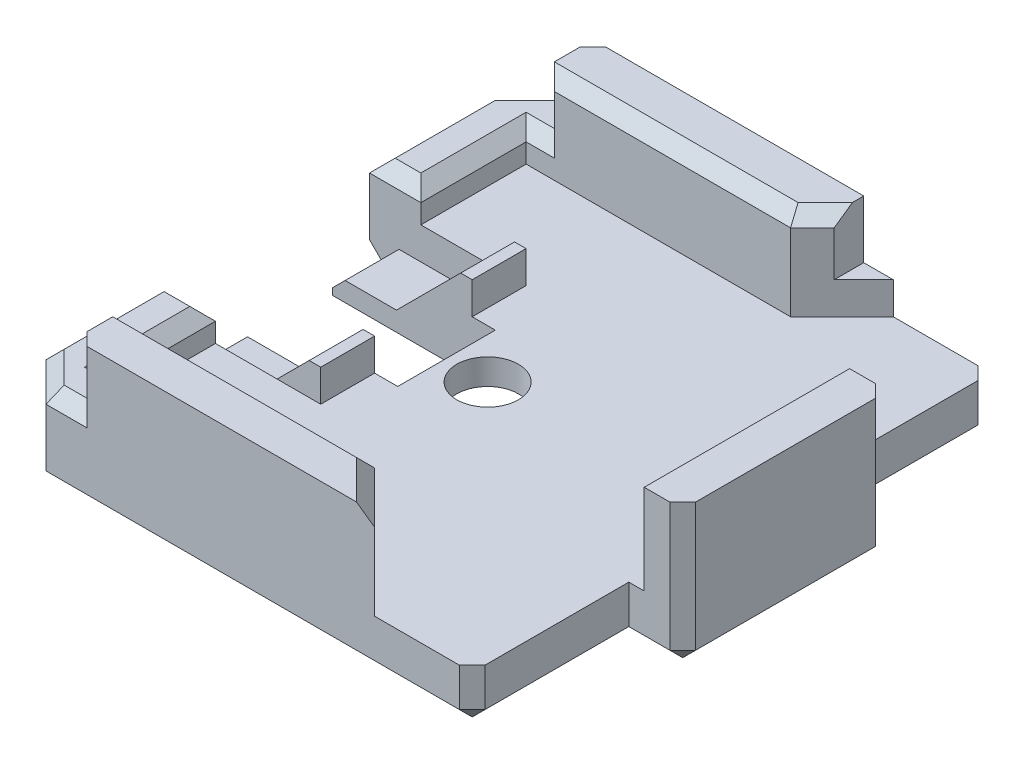
from build123d import *

# Parameters (mm, degrees)
SKETCH1_R           = 1.2
BOSS_EXTRUDE1_DEPTH = 2
SKETCH2_W           = 2
SKETCH2_H           = 8
BOSS_EXTRUDE2_DEPTH = 1.25
SKETCH3_W           = 2
SKETCH3_H           = 8
BOSS_EXTRUDE3_DEPTH = 2.25
CUT_EXTRUDE1_DEPTH  = 1
CUT_EXTRUDE2_DEPTH  = 2.1
CUT_EXTRUDE3_DEPTH  = 2.1
CHAMFER1_SIZE       = 1.5
CHAMFER2_SIZE       = 0.5


with BuildPart() as part:
    # Sketch1 → Boss-Extrude1 (new body)
    with BuildSketch(Plane(origin=(0, 0, 0), x_dir=(1, 0, 0), z_dir=(0, 1, 0))):
        Polygon((-8.6, -10.1), (9.5, -10.1), (9.5, -4), (11.6, -4), (11.6, 4), (9.5, 4), (9.5, 10.1), (-8.6, 10.1), (-8.6, 4), (-7.95, 4), (-7.95, 1.9), (-1.6, 1.9), (-1.6, -1.9), (-7.95, -1.9), (-7.95, -4), (-8.6, -4), align=None)
        with Locations(Location((0, 0, 0), (0, 0, 270))):
            Circle(SKETCH1_R, mode=Mode.SUBTRACT)
    extrude(amount=BOSS_EXTRUDE1_DEPTH)

    # Sketch2 → Boss-Extrude2 (add)
    with BuildSketch(Plane(origin=(0, 2, 0), x_dir=(1, 0, 0), z_dir=(0, 1, 0))):
        Polygon((-8.6, -4), (-7.95, -4), (-7.95, -1.9), (-2.5, -1.9), (-2.5, -4), (-6.6, -4), (-6.6, -8.1), (3.7, -8.1), (5.7, -10.1), (-8.6, -10.1), align=None)
        Polygon((-8.6, 10.1), (-8.6, 4), (-7.95, 4), (-7.95, 1.9), (-2.5, 1.9), (-2.5, 4), (-6.6, 4), (-6.6, 8.1), (3.7, 8.1), (5.7, 10.1), align=None)
        with Locations((10.6, 0)):
            Rectangle(SKETCH2_W, SKETCH2_H)
    extrude(amount=BOSS_EXTRUDE2_DEPTH)

    # Sketch3 → Boss-Extrude3 (add)
    with BuildSketch(Plane(origin=(0, 3.25, 0), x_dir=(1, 0, 0), z_dir=(0, 1, 0))):
        with Locations((10.6, 0)):
            Rectangle(SKETCH3_W, SKETCH3_H)
        Polygon((3.7, -8.1), (-6, -8.1), (-6, -10.1), (5.7, -10.1), align=None)
        Polygon((3.7, 8.1), (-6, 8.1), (-6, 10.1), (4.55, 10.1), (4.55, 8.95), align=None)
    extrude(amount=BOSS_EXTRUDE3_DEPTH)

    # Sketch4 → Cut-Extrude1 (cut)
    with BuildSketch(Plane.XZ):
        Polygon((-2.309401077, 0), (-1.154700538, -2), (1.154700538, -2), (2.309401077, 0), (1.154700538, 2), (-1.154700538, 2), align=None)
    extrude(amount=-CUT_EXTRUDE1_DEPTH, mode=Mode.SUBTRACT)

    # Sketch5 → Cut-Extrude2 (cut)
    with BuildSketch(Plane(origin=(0, 0, 1.9), x_dir=(-1, 0, 0), z_dir=(0, 0, -1))):
        Polygon((7.95, 0.75), (5.45, 0.75), (2.95, 3.25), (7.95, 3.25), align=None)
    extrude(amount=-CUT_EXTRUDE2_DEPTH, mode=Mode.SUBTRACT)

    # Sketch6 → Cut-Extrude3 (cut)
    with BuildSketch(Plane.XY.offset(-1.9)):
        Polygon((-7.95, 3.25), (-7.95, 0.75), (-5.45, 0.75), (-2.95, 3.25), align=None)
    extrude(amount=-CUT_EXTRUDE3_DEPTH, mode=Mode.SUBTRACT)

    # Chamfer1
    chamfer1_edges = [part.edges().sort_by_distance(p)[0] for p in [
        (-8.6, 1.625, -10.1),
        (-8.6, 1.625, 10.1),
    ]]
    chamfer(chamfer1_edges, length=CHAMFER1_SIZE)

    # Chamfer2
    chamfer2_edges = [part.edges().sort_by_distance(p)[0] for p in [
        (11.6, 2.75, -4),
        (11.6, 2.75, 4),
        (-8.6, 0, 6.3),
        (-7.85, 0, 9.35),
        (-8.6, 0, -6.3),
        (-7.85, 0, -9.35),
        (1.2, 0, -10.1),
        (9.5, 0, -7.05),
        (10.55, 0, -4),
        (1.2, 0, 10.1),
        (9.5, 0, 7.05),
        (10.55, 0, 4),
        (11.6, 0, 0),
        (-1.377350269, 0, -1.614359354),
        (0, 0, -2),
        (-1.377350269, 0, 1.614359354),
        (0, 0, 2),
        (1.732050808, 0, 1),
        (1.732050808, 0, -1),
        (-1.15, 5.5, -8.1),
        (-6, 4.375, -8.1),
        (-6.3, 3.25, -8.1),
        (-6.6, 3.25, -6.05),
        (-7.6, 3.25, -4),
        (-6.55, 3.25, -10.1),
        (-7.85, 3.25, -9.35),
        (-8.6, 3.25, -6.3),
        (-7.95, 0.75, 2.95),
        (-7.95, 0.75, -2.95),
        (9.6, 3.75, 4),
        (9.6, 3.75, -4),
        (9.6, 5.5, 0),
        (-1.15, 5.5, 8.1),
        (-6, 4.375, 8.1),
        (-6.3, 3.25, 8.1),
        (-6.6, 3.25, 6.05),
        (-7.6, 3.25, 4),
        (-6.55, 3.25, 10.1),
        (-7.85, 3.25, 9.35),
        (-8.6, 3.25, 6.3),
        (9.5, 1, -10.1),
        (9.5, 1, 10.1),
        (4.125, 5.5, -8.525),
        (4.7, 5.5, 9.1),
        (-6, 4.375, -10.1),
        (-6, 4.375, 10.1),
    ]]
    chamfer(chamfer2_edges, length=CHAMFER2_SIZE)


solid = part.part
